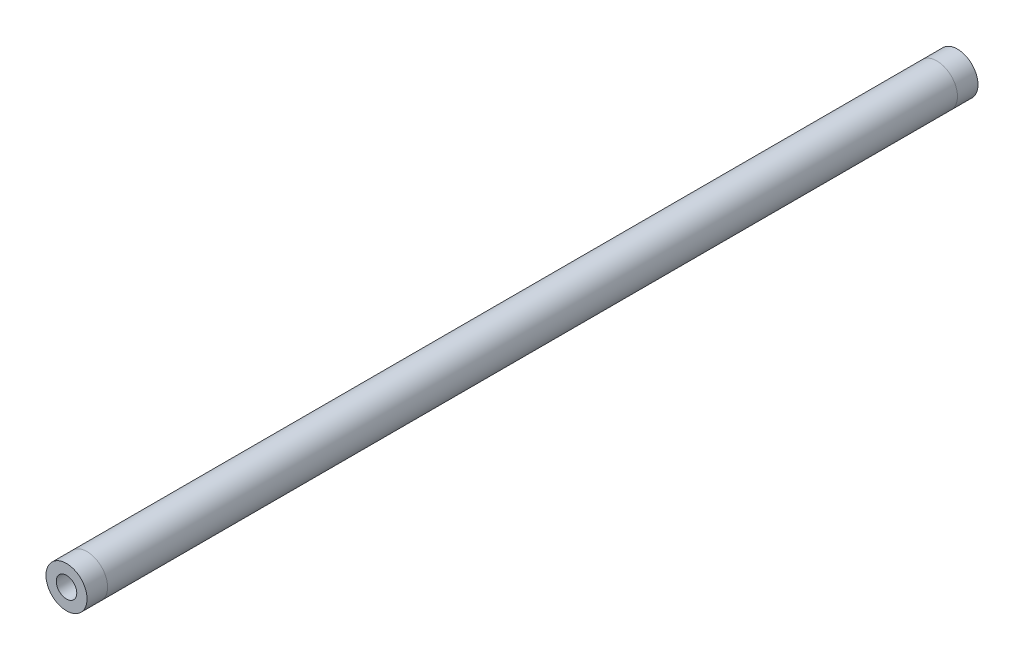
from build123d import *

# Parameters (mm, degrees)
SKETCH1_R                 = 6.35
SKETCH1_R_2               = 4.8514
SKETCH1_R_3               = 3.175
THREADED_INSERT_1_1_DEPTH = 6.35
THREADED_START            = -6.35
SKETCH1_3_R               = 4.8514
SKETCH1_3_R_2             = 3.175
THREADED_INSERT_1_2_DEPTH = 9.525
TUBE_START                = -6.35
SKETCH1_4_R               = 6.35
SKETCH1_4_R_2             = 4.8514
TUBE_EXTRUDE_DEPTH        = 262.689418
THREADED_START_2          = -269.039418
SKETCH1_6_R               = 4.8514
SKETCH1_6_R_2             = 3.175
THREADED_INSERT_2_1_DEPTH = 9.525
SKETCH1_9_R               = 6.35
SKETCH1_9_R_2             = 4.8514
SKETCH1_9_R_3             = 3.175
THREADED_INSERT_2_2_DEPTH = 6.35


with BuildPart() as part:
    # Sketch1 → Threaded insert 1-1 (new body)
    # profile 1 of 2: a face of its own
    with BuildSketch(Plane.XY):
        Circle(SKETCH1_R)
        Circle(SKETCH1_R_2, mode=Mode.SUBTRACT)
    # profile 2 of 2: a face of its own
    with BuildSketch(Plane.XY):
        Circle(SKETCH1_R_2)
        Circle(SKETCH1_R_3, mode=Mode.SUBTRACT)
    extrude(amount=-THREADED_INSERT_1_1_DEPTH)

    # Sketch1<3> → Threaded insert 1-2 (add)
    with BuildSketch(Plane.XY.offset(THREADED_START)):
        Circle(SKETCH1_3_R)
        Circle(SKETCH1_3_R_2, mode=Mode.SUBTRACT)
    extrude(amount=-THREADED_INSERT_1_2_DEPTH)


with BuildPart() as body_2:
    # Sketch1<4> → Tube extrude (new body)
    with BuildSketch(Plane.XY.offset(TUBE_START)):
        Circle(SKETCH1_4_R)
        Circle(SKETCH1_4_R_2, mode=Mode.SUBTRACT)
    extrude(amount=-TUBE_EXTRUDE_DEPTH)


with BuildPart() as body_3:
    # Sketch1<6> → Threaded insert 2-1 (new body)
    with BuildSketch(Plane.XY.offset(THREADED_START_2)):
        Circle(SKETCH1_6_R)
        Circle(SKETCH1_6_R_2, mode=Mode.SUBTRACT)
    extrude(amount=THREADED_INSERT_2_1_DEPTH)


with BuildPart() as body_4:
    # Sketch1<9> → Threaded insert 2-2 (new body)
    # profile 1 of 2: a face of its own
    with BuildSketch(Plane.XY.offset(THREADED_START_2)):
        Circle(SKETCH1_9_R)
        Circle(SKETCH1_9_R_2, mode=Mode.SUBTRACT)
    # profile 2 of 2: a face of its own
    with BuildSketch(Plane.XY.offset(THREADED_START_2)):
        Circle(SKETCH1_9_R_2)
        Circle(SKETCH1_9_R_3, mode=Mode.SUBTRACT)
    extrude(amount=-THREADED_INSERT_2_2_DEPTH)

    # Combine1: union body 3
    add(body_3.part)


solid = Compound([part.part, body_2.part, body_4.part])
